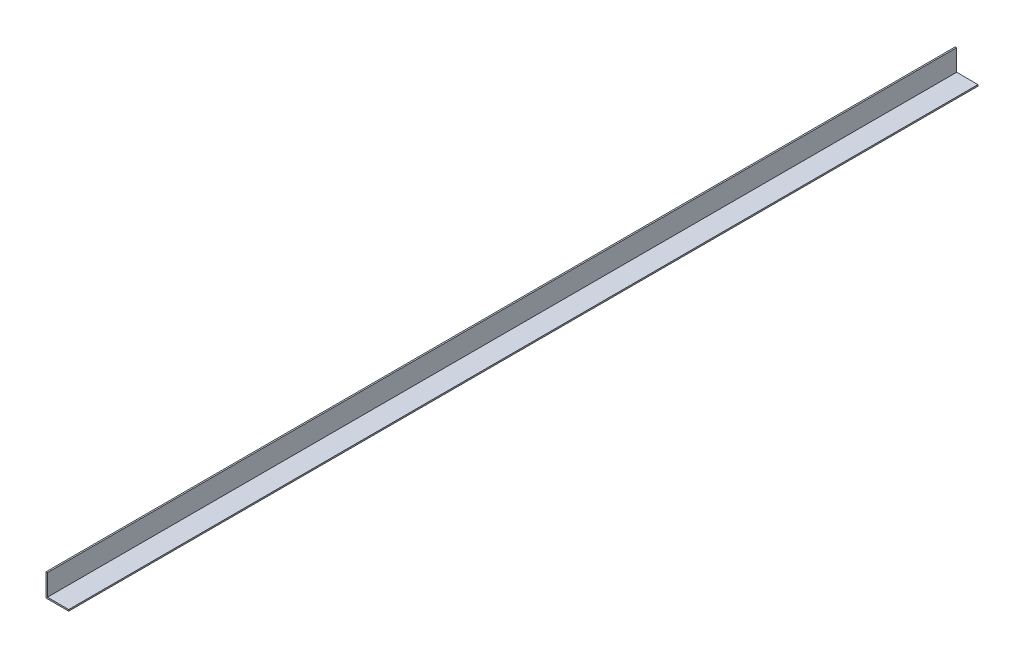
from build123d import *

# Parameters (mm, degrees)
BOSS_EXTRUDE1_DEPTH = 1016


with BuildPart() as part:
    # Sketch1 → Boss-Extrude1 (new body)
    with BuildSketch(Plane.XY):
        Polygon((0, 25.4), (0, 0), (25.4, 0), (25.4, 1.5875), (1.5875, 1.5875), (1.5875, 25.4), align=None)
    extrude(amount=BOSS_EXTRUDE1_DEPTH)


solid = part.part
